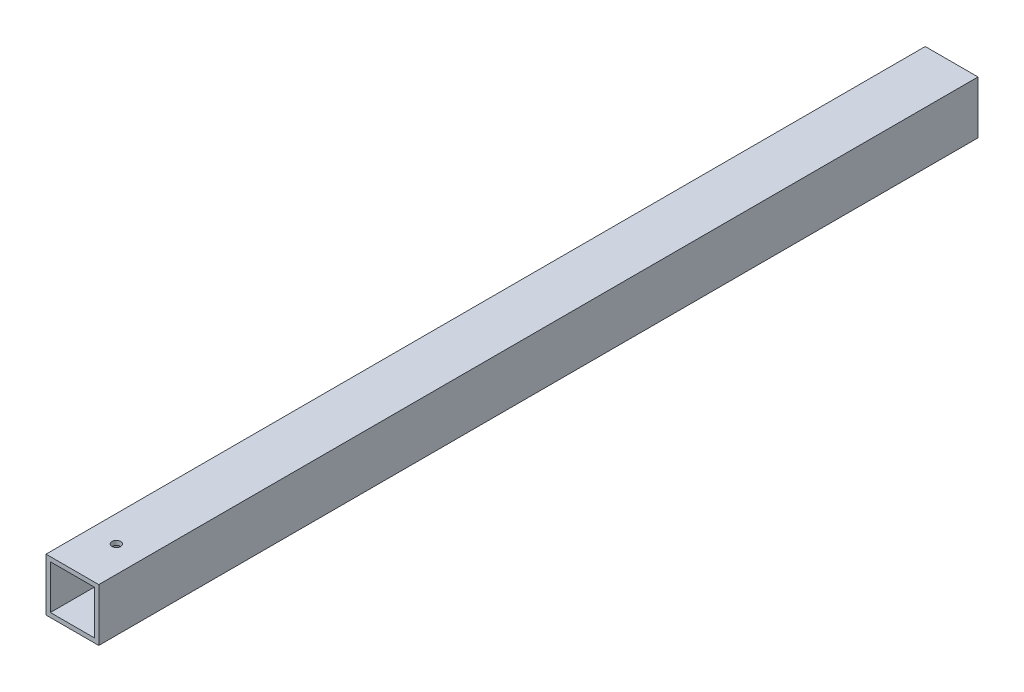
from build123d import *

# Parameters (mm, degrees)
SKETCH_1_W          = 12
SKETCH_1_H          = 12
SKETCH_1_W_2        = 10
SKETCH_1_H_2        = 10
EXTRUDE_1_DEPTH     = 200
SKETCH_2_R          = 1
CUT_EXTRUDE_1_DEPTH = 12


with BuildPart() as part:
    # 草图1 → 凸台-拉伸1 (new body)
    with BuildSketch(Plane.XY):
        with Locations((6, 6)):
            Rectangle(SKETCH_1_W, SKETCH_1_H)
        with Locations((6, 6)):
            Rectangle(SKETCH_1_W_2, SKETCH_1_H_2, mode=Mode.SUBTRACT)
    extrude(amount=EXTRUDE_1_DEPTH)

    # 草图2 → 切除-拉伸1 (cut)
    with BuildSketch(Plane.XZ):
        with Locations(Location((6, 190, 0), (0, 0, 270))):
            Circle(SKETCH_2_R)
    extrude(amount=-CUT_EXTRUDE_1_DEPTH, mode=Mode.SUBTRACT)


solid = part.part
